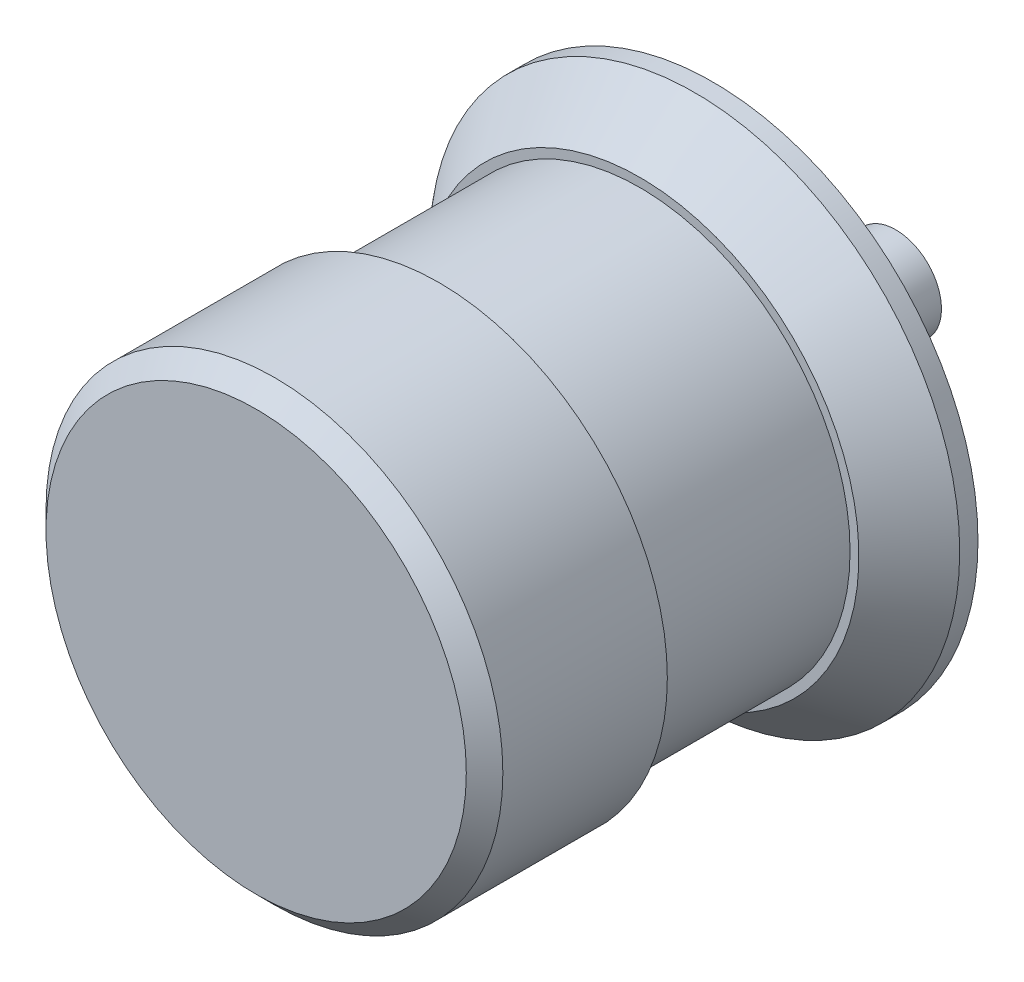
from build123d import *

# Parameters (mm, degrees)
SKETCH1_R           = 29
BOSS_EXTRUDE1_DEPTH = 30
SKETCH2_OUTSIDE_W   = 77.468
SKETCH2_OUTSIDE_H   = 77.468
SKETCH2_OUTSIDE_R   = 23
CUT_EXTRUDE1_DEPTH  = 22
CHAMFER1_SIZE       = 6
CHAMFER1_SIZE2      = 5.034597787
SKETCH3_R           = 25
BOSS_EXTRUDE2_DEPTH = 20
SKETCH4_R           = 5
BOSS_EXTRUDE3_DEPTH = 20
CHAMFER2_SIZE       = 2


with BuildPart() as part:
    # Sketch1 → Boss-Extrude1 (new body)
    with BuildSketch(Plane.XY):
        Circle(SKETCH1_R)
    extrude(amount=BOSS_EXTRUDE1_DEPTH)

    # Sketch2 outside → Cut-Extrude1 (cut)
    with BuildSketch(Plane.XY.offset(30)):
        Rectangle(SKETCH2_OUTSIDE_W, SKETCH2_OUTSIDE_H)
        Circle(SKETCH2_OUTSIDE_R, mode=Mode.SUBTRACT)
    extrude(amount=-CUT_EXTRUDE1_DEPTH, mode=Mode.SUBTRACT)

    # Chamfer1
    chamfer1_edges = [part.edges().sort_by_distance(p)[0] for p in [
        (-29, 0, 8),
    ]]
    chamfer1_side = [part.faces().sort_by_distance(p)[0] for p in [
        (-29, 0, 4),
    ]]
    chamfer(chamfer1_edges, length=CHAMFER1_SIZE, length2=CHAMFER1_SIZE2, reference=chamfer1_side[0])

    # Sketch3 → Boss-Extrude2 (add)
    with BuildSketch(Plane.XY.offset(30)):
        Circle(SKETCH3_R)
    extrude(amount=BOSS_EXTRUDE2_DEPTH)

    # Sketch4 → Boss-Extrude3 (add)
    with BuildSketch(Plane(origin=(0, 0, 0), x_dir=(-1, 0, 0), z_dir=(0, 0, -1))):
        Circle(SKETCH4_R)
    extrude(amount=BOSS_EXTRUDE3_DEPTH)

    # Chamfer2
    chamfer2_edges = [part.edges().sort_by_distance(p)[0] for p in [
        (-25, 0, 50),
    ]]
    chamfer(chamfer2_edges, length=CHAMFER2_SIZE)


solid = part.part
